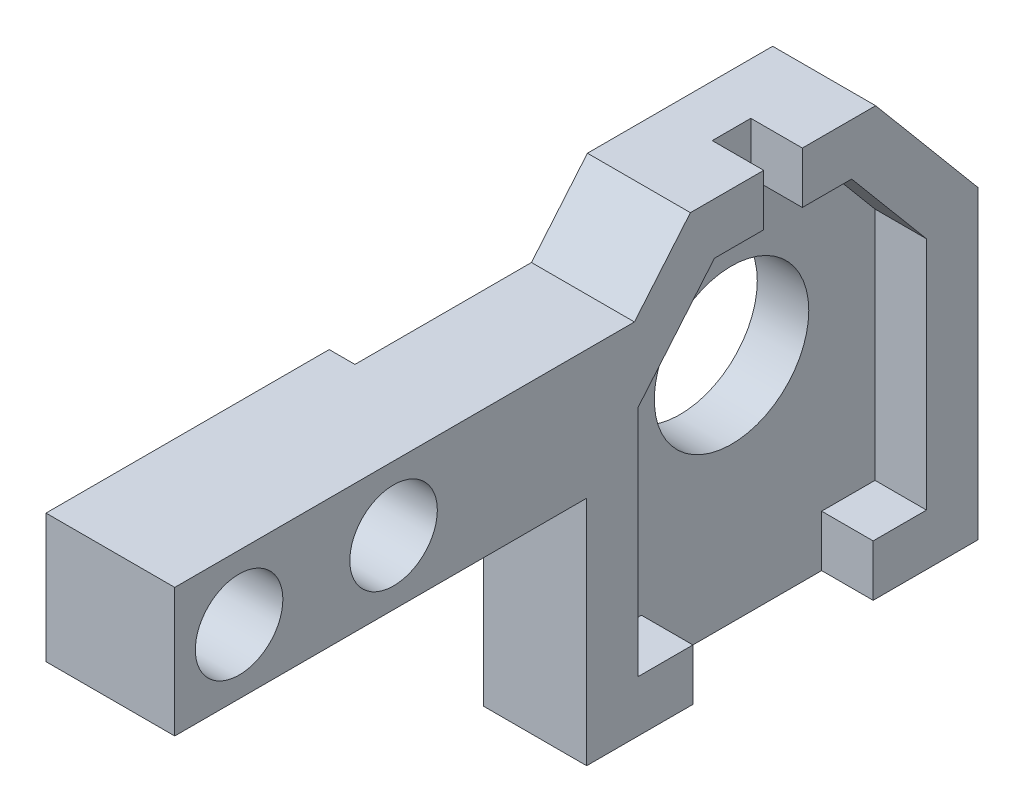
from build123d import *

# Parameters (mm, degrees)
BOSS_EXTRUDE1_DEPTH = 2
BOSS_EXTRUDE2_DEPTH = 2
SKETCH3_R           = 3
CUT_EXTRUDE1_DEPTH  = 2
SKETCH4_R           = 1.7
BOSS_EXTRUDE3_DEPTH = 5
CUT_EXTRUDE2_DEPTH  = 1


with BuildPart() as part:
    # Sketch2 → Boss-Extrude1 (new body)
    with BuildSketch(Plane(origin=(0, 0, 0), x_dir=(0, 0, -1), z_dir=(1, 0, 0))):
        Polygon((-8.109308511, -7.091340238), (-8.109308511, 4.696600231), (-4.079902129, 9.498659762), (3.11566899, 9.498659762), (7.090691489, 4.761412419), (7.090691489, -7.091340238), align=None)
    extrude(amount=-BOSS_EXTRUDE1_DEPTH)

    # Sketch1 → Boss-Extrude2 (add)
    with BuildSketch(Plane(origin=(0, 0, 0), x_dir=(0, 0, -1), z_dir=(1, 0, 0))):
        Polygon((-6.109308511, 3.968659762), (-3.147286813, 7.498659762), (-1.232116569, 7.498659762), (-1.232116569, 9.498659762), (-4.079902129, 9.498659762), (-8.109308511, 4.696600231), (-8.109308511, -7.091340238), (-3.982116569, -7.091340238), (-3.982116569, -5.091340238), (-6.109308511, -5.091340238), align=None)
        Polygon((5.090691489, 4.03347195), (5.090691489, -5.091340238), (3.017883431, -5.091340238), (3.017883431, -7.091340238), (7.090691489, -7.091340238), (7.090691489, 4.761412419), (3.11566899, 9.498659762), (0.267883431, 9.498659762), (0.267883431, 7.498659762), (2.183053674, 7.498659762), align=None)
    extrude(amount=BOSS_EXTRUDE2_DEPTH)

    # Sketch3 → Cut-Extrude1 (cut)
    with BuildSketch(Plane(origin=(0, 0, 0), x_dir=(0, 0, -1), z_dir=(1, 0, 0))):
        with Locations((-0.482116569, 1.908659762)):
            Circle(SKETCH3_R)
    extrude(amount=-CUT_EXTRUDE1_DEPTH, mode=Mode.SUBTRACT)

    # Sketch4 → Boss-Extrude3 (add)
    with BuildSketch(Plane(origin=(2, 0, 0), x_dir=(0, 0, -1), z_dir=(1, 0, 0))):
        Polygon((-15.482116569, 1.908659762), (-8.109308511, 1.908659762), (-8.109308511, 4.696600231), (-6.253170174, 6.908659762), (-20.486049047, 6.908659762), (-24.109308511, 6.908659762), (-24.109308511, 1.908659762), align=None)
        with Locations((-15.609308511, 4.408659762)):
            Circle(SKETCH4_R, mode=Mode.SUBTRACT)
        with Locations((-21.609308511, 4.408659762)):
            Circle(SKETCH4_R, mode=Mode.SUBTRACT)
    extrude(amount=-BOSS_EXTRUDE3_DEPTH)

    # Sketch5 → Cut-Extrude2 (cut)
    with BuildSketch(Plane.ZY.offset(3)):
        Polygon((8.109308511, 6.908659762), (6.253170174, 6.908659762), (8.109308511, 4.696600231), (8.109308511, 1.908659762), (13.109308511, 1.908659762), (13.109308511, 6.908659762), align=None)
    extrude(amount=-CUT_EXTRUDE2_DEPTH, mode=Mode.SUBTRACT)


solid = part.part
